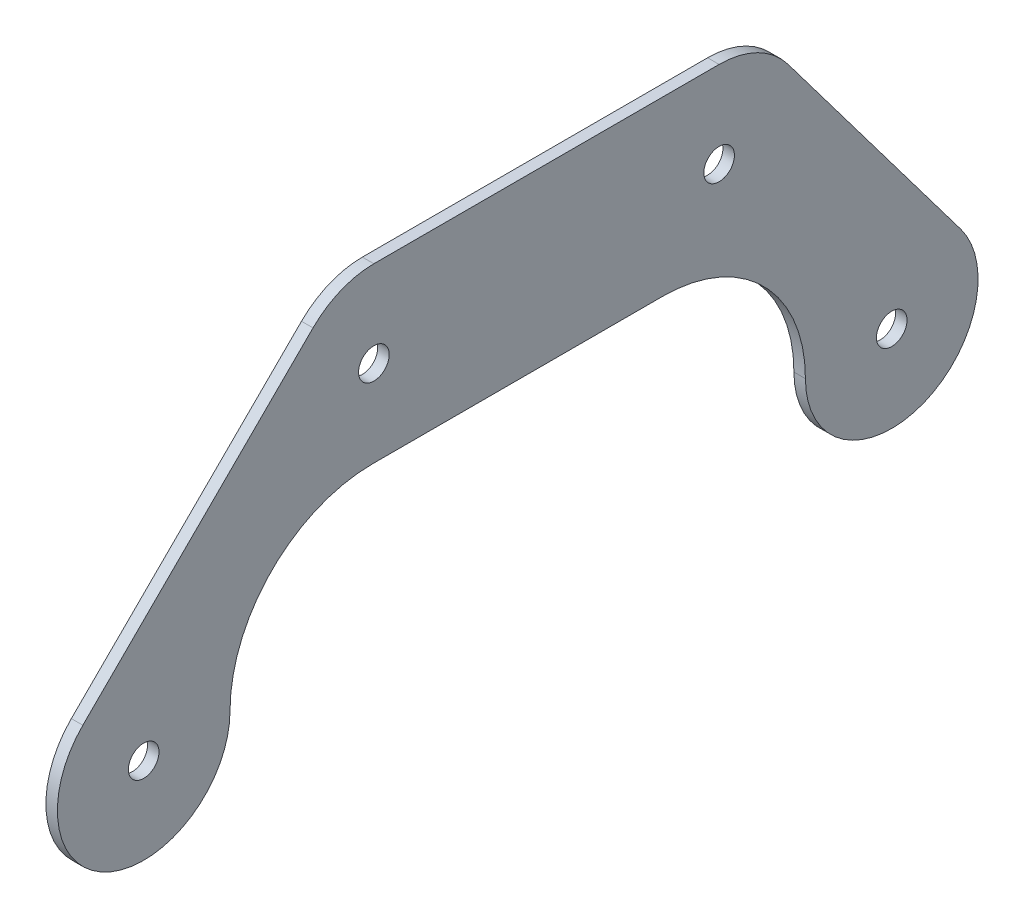
from build123d import *

# Parameters (mm, degrees)
BOSS_EXTRUDE1_DEPTH     = 2.54
F_1_4_CLEARANCE_HOLE1_D = 6.7564


with BuildPart() as part:
    # Sketch1 → Boss-Extrude1 (new body)
    with BuildSketch(Plane(origin=(0, 0, 0), x_dir=(0, 0, -1), z_dir=(1, 0, 0))):
        with BuildLine():
            Line((-13.43658162, 13.504102131), (37.36341838, 64.050102131))
            ThreePointArc((37.36341838, 64.050102131), (43.531941304, 68.155026742), (50.8, 69.596))
            Line((50.8, 69.596), (127, 69.596))
            ThreePointArc((127, 69.596), (135.498900621, 67.595081742), (142.212435842, 62.012660183))
            Line((142.212435842, 62.012660183), (180.312435842, 11.466660183))
            ThreePointArc((180.312435842, 11.466660183), (171.145891051, -18.065151574), (146.05, 0))
            ThreePointArc((146.05, 0), (136.82503518, 22.27103518), (114.554, 31.496))
            Line((114.554, 31.496), (50.546, 31.496))
            ThreePointArc((50.546, 31.496), (28.27496482, 22.27103518), (19.05, 0))
            ThreePointArc((19.05, 0), (-7.31216863, -17.590755809), (-13.43658162, 13.504102131))
        make_face()
    extrude(amount=BOSS_EXTRUDE1_DEPTH)

    # 1/4 Clearance Hole1 (through all)
    with Locations(Plane(origin=(2.54, 0, 0), x_dir=(0, 0, -1), z_dir=(1, 0, 0))):
        with Locations((50.8, 50.546), (127, 50.546), (165.1, 0), (0, 0)):
            Hole(F_1_4_CLEARANCE_HOLE1_D / 2)


solid = part.part
